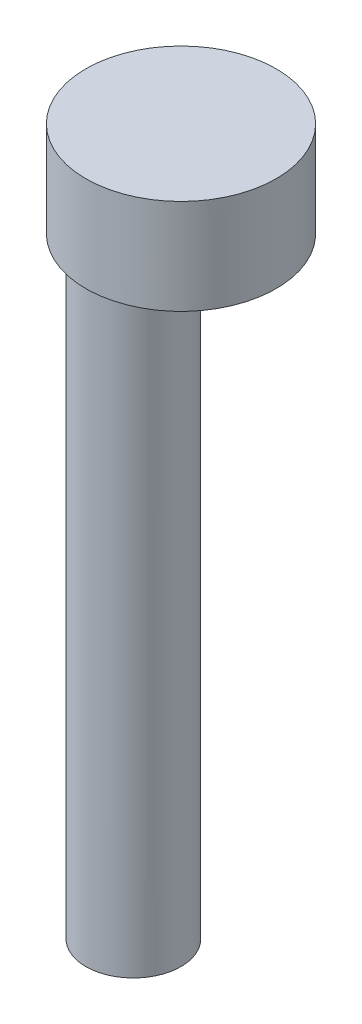
from build123d import *

# Parameters (mm, degrees)
SKETCH1_R           = 0.75
BOSS_EXTRUDE1_DEPTH = 10
SKETCH2_R           = 1.5
BOSS_EXTRUDE2_DEPTH = 1.5


with BuildPart() as part:
    # Sketch1 → Boss-Extrude1 (new body)
    with BuildSketch(Plane(origin=(0, 0, 0), x_dir=(1, 0, 0), z_dir=(0, 1, 0))):
        with Locations(Location((0, 0, 0), (0, 0, 270))):
            Circle(SKETCH1_R)
    extrude(amount=BOSS_EXTRUDE1_DEPTH)

    # Sketch2 → Boss-Extrude2 (add)
    with BuildSketch(Plane(origin=(0, 10, 0), x_dir=(1, 0, 0), z_dir=(0, 1, 0))):
        with Locations(Location((0.75, 0, 0), (0, 0, 180))):
            Circle(SKETCH2_R)
    extrude(amount=BOSS_EXTRUDE2_DEPTH)


solid = part.part
